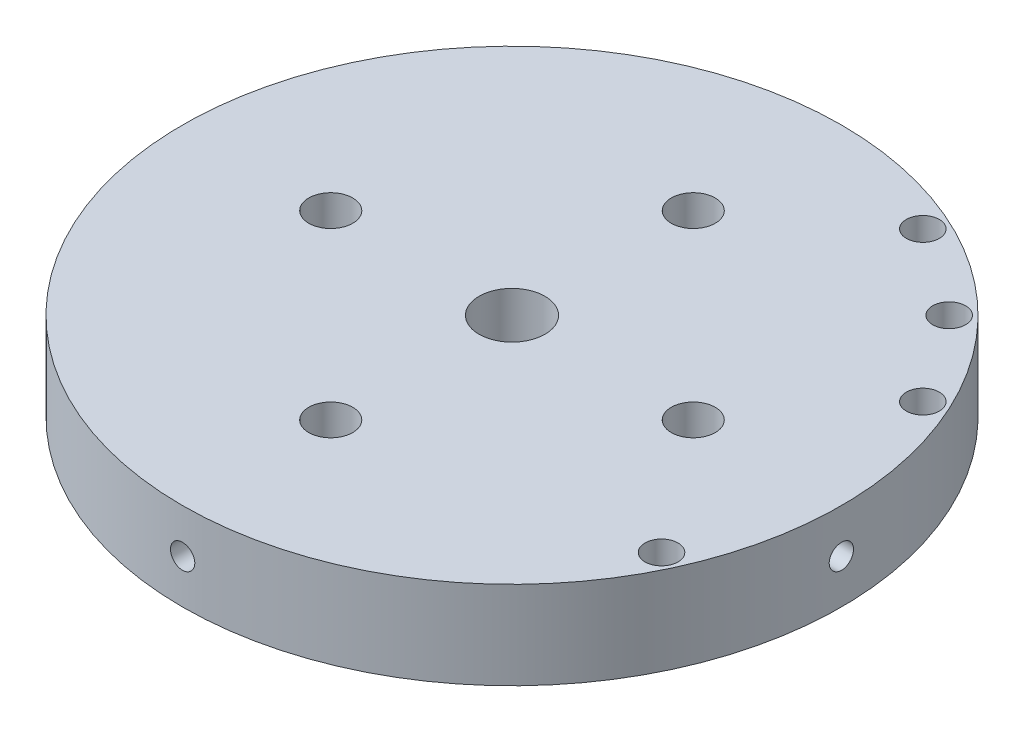
from build123d import *

# Parameters (mm, degrees)
SKETCH1_R           = 47.625
BOSS_EXTRUDE1_DEPTH = 12.7
SKETCH6_R           = 1.7526
CUT_EXTRUDE3_DEPTH  = 19.05
CIRPATTERN4_COUNT   = 4
SKETCH7_R           = 3.175
CUT_EXTRUDE6_DEPTH  = 69.538830402
SKETCH8_R           = 4.7625
CUT_EXTRUDE7_DEPTH  = 69.538830402
SKETCH11_R          = 2.38125
CUT_EXTRUDE8_DEPTH  = 69.538830402


with BuildPart() as part:
    # Sketch1 → Boss-Extrude1 (new body)
    with BuildSketch(Plane(origin=(0, 0, 0), x_dir=(1, 0, 0), z_dir=(0, 1, 0))):
        with Locations(Location((0, 0, 0), (0, 0, 270))):
            Circle(SKETCH1_R)
    extrude(amount=BOSS_EXTRUDE1_DEPTH)

    # Sketch6 → Cut-Extrude3 (cut)
    with BuildSketch(Plane(origin=(0, 0, -47.625), x_dir=(0, -1, 0), z_dir=(0, 0, -1))):
        with Locations(Location((-6.35, 0, 0), (0, 0, 90))):
            Circle(SKETCH6_R)
    cut_extrude3 = extrude(amount=-CUT_EXTRUDE3_DEPTH, mode=Mode.SUBTRACT)

    # CirPattern4: Cut-Extrude3 ×4 about axis
    cirpattern4_axis = Axis((0, 0, 0), (0, 1, 0))
    for i in range(1, CIRPATTERN4_COUNT):
        add(cut_extrude3.rotate(cirpattern4_axis, i * 360 / CIRPATTERN4_COUNT), mode=Mode.SUBTRACT)

    # Sketch7 → Cut-Extrude6 (cut, through all)
    with BuildSketch(Plane(origin=(0, 0, 0), x_dir=(1, 0, 0), z_dir=(0, 1, 0))):
        with Locations(Location((-26.19375, 0, 0), (0, 0, 270))):
            Circle(SKETCH7_R)
        with Locations(Location((26.19375, 0, 0), (0, 0, 270))):
            Circle(SKETCH7_R)
        with Locations(Location((0, 26.19375, 0), (0, 0, 270))):
            Circle(SKETCH7_R)
        with Locations(Location((0, -26.19375, 0), (0, 0, 270))):
            Circle(SKETCH7_R)
    extrude(amount=CUT_EXTRUDE6_DEPTH, mode=Mode.SUBTRACT)

    # Sketch8 → Cut-Extrude7 (cut, through all)
    with BuildSketch(Plane(origin=(0, 12.7, 0), x_dir=(1, 0, 0), z_dir=(0, 1, 0))):
        with Locations(Location((0, 0, 0), (0, 0, 270))):
            Circle(SKETCH8_R)
    extrude(amount=-CUT_EXTRUDE7_DEPTH, mode=Mode.SUBTRACT)

    # Sketch11 → Cut-Extrude8 (cut, through all)
    with BuildSketch(Plane(origin=(0, 12.7, 0), x_dir=(1, 0, 0), z_dir=(0, 1, 0))):
        with Locations(Location((31.589006405, 31.589006405, 0), (0, 0, 270))):
            Circle(SKETCH11_R)
        with Locations(Location((40.488032715, 18.879879719, 0), (0, 0, 270))):
            Circle(SKETCH11_R)
        with Locations(Location((18.879879719, 40.488032715, 0), (0, 0, 270))):
            Circle(SKETCH11_R)
        with Locations(Location((40.488032715, -18.879879719, 0), (0, 0, 270))):
            Circle(SKETCH11_R)
    extrude(amount=-CUT_EXTRUDE8_DEPTH, mode=Mode.SUBTRACT)


solid = part.part
